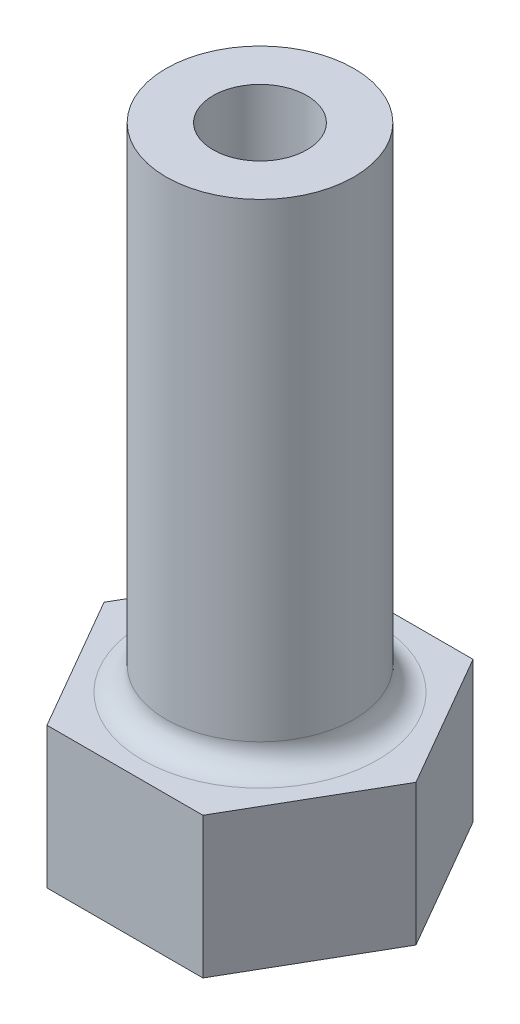
from build123d import *

# Parameters (mm, degrees)
SKETCH_1_R               = 4
EXTRUDE_2_DEPTH          = 27
SKETCH_1_5_R             = 4
EXTRUDE_3_DEPTH          = 6
FILLET_1_R               = 1
CUT_EXTRUDE_1_DEPTH      = 29.392707397
CUT_EXTRUDE_1_DEPTH_BACK = 29.392707397
SKETCH_2_R               = 2


with BuildPart() as part:
    # 草图1 → 凸台-拉伸2 (new body)
    with BuildSketch(Plane(origin=(0, 0, 0), x_dir=(1, 0, 0), z_dir=(0, 1, 0))):
        Circle(SKETCH_1_R)
    extrude(amount=EXTRUDE_2_DEPTH)

    # 草图1<5> → 凸台-拉伸3 (add)
    with BuildSketch(Plane(origin=(0, 0, 0), x_dir=(1, 0, 0), z_dir=(0, 1, 0))):
        Polygon((6.639528096, 0), (3.319764048, 5.75), (-3.319764048, 5.75), (-6.639528096, 0), (-3.319764048, -5.75), (3.319764048, -5.75), align=None)
        Circle(SKETCH_1_5_R, mode=Mode.SUBTRACT)
    extrude(amount=EXTRUDE_3_DEPTH)

    # 圆角1
    fillet_1_edges = [part.edges().sort_by_distance(p)[0] for p in [
        (-4, 6, 0),
    ]]
    fillet(fillet_1_edges, radius=FILLET_1_R)

    # 草图2 → 切除-拉伸1 (cut, two sides: drawn at the far end of the back side and taken through both)
    with BuildSketch(Plane(origin=(0, 0, 0), x_dir=(1, 0, 0), z_dir=(0, 1, 0)).offset(-CUT_EXTRUDE_1_DEPTH_BACK)):
        Circle(SKETCH_2_R)
    extrude(amount=CUT_EXTRUDE_1_DEPTH + CUT_EXTRUDE_1_DEPTH_BACK, mode=Mode.SUBTRACT)


solid = part.part
